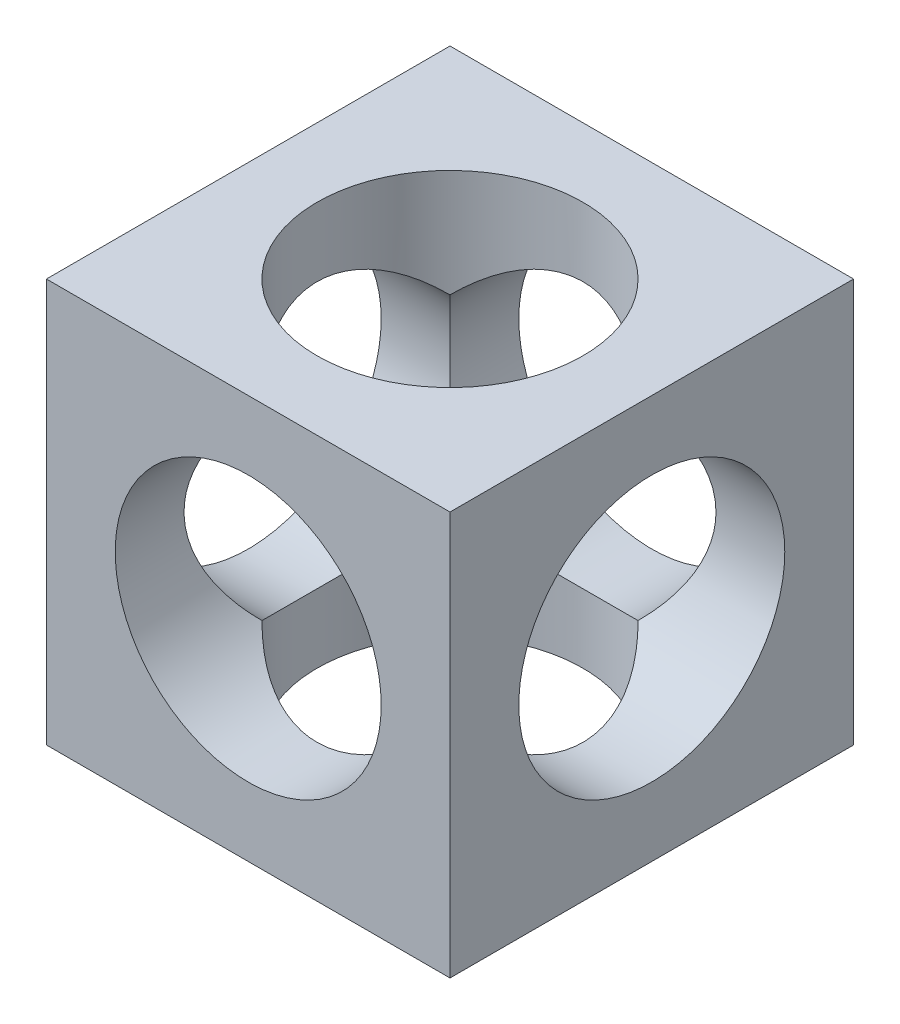
from build123d import *

# Parameters (mm, degrees)
ESQUISSE1_W                 = 22
ESQUISSE1_H                 = 22
BOSS_EXTRU_1_DEPTH          = 22
D_GAGEMENT_M131_D           = 14.5
D_GAGEMENT_M131_ON_FACE_2_D = 14.5
D_GAGEMENT_M131_ON_FACE_3_D = 14.5


with BuildPart() as part:
    # Esquisse1 → Boss.-Extru.1 (new body)
    with BuildSketch(Plane.XY):
        Rectangle(ESQUISSE1_W, ESQUISSE1_H)
    extrude(amount=BOSS_EXTRU_1_DEPTH)

    # Dégagement M131 (through all)
    with Locations(Plane(origin=(0, 11, 11), x_dir=(0, 0, 1), z_dir=(0, 1, 0))):
        with Locations((0, 0)):
            Hole(D_GAGEMENT_M131_D / 2)

    # Dégagement M131 on face 2 (through all)
    with Locations(Plane.XY.offset(22)):
        with Locations((0, 0)):
            Hole(D_GAGEMENT_M131_ON_FACE_2_D / 2)

    # Dégagement M131 on face 3 (through all)
    with Locations(Plane(origin=(11, 0, 11), x_dir=(0, 0, 1), z_dir=(1, 0, 0))):
        with Locations((0, 0)):
            Hole(D_GAGEMENT_M131_ON_FACE_3_D / 2)


solid = part.part
